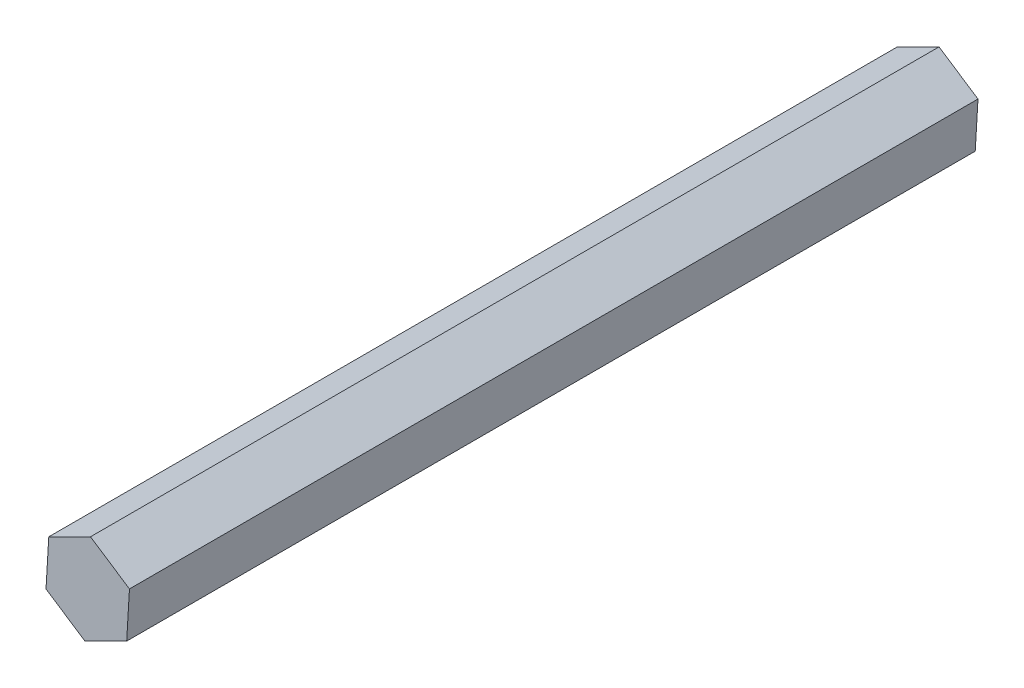
from build123d import *

# Parameters (mm, degrees)
BOSS_EXTRUDE1_DEPTH = 100


with BuildPart() as part:
    # Sketch1 → Boss-Extrude1 (new body)
    with BuildSketch(Plane.XY):
        Polygon((4.917660911, 2.461399228), (0.327196195, 5.489518891), (-4.590464716, 3.028119662), (-4.917660911, -2.461399228), (-0.327196195, -5.489518891), (4.590464716, -3.028119662), align=None)
    extrude(amount=BOSS_EXTRUDE1_DEPTH)


solid = part.part
